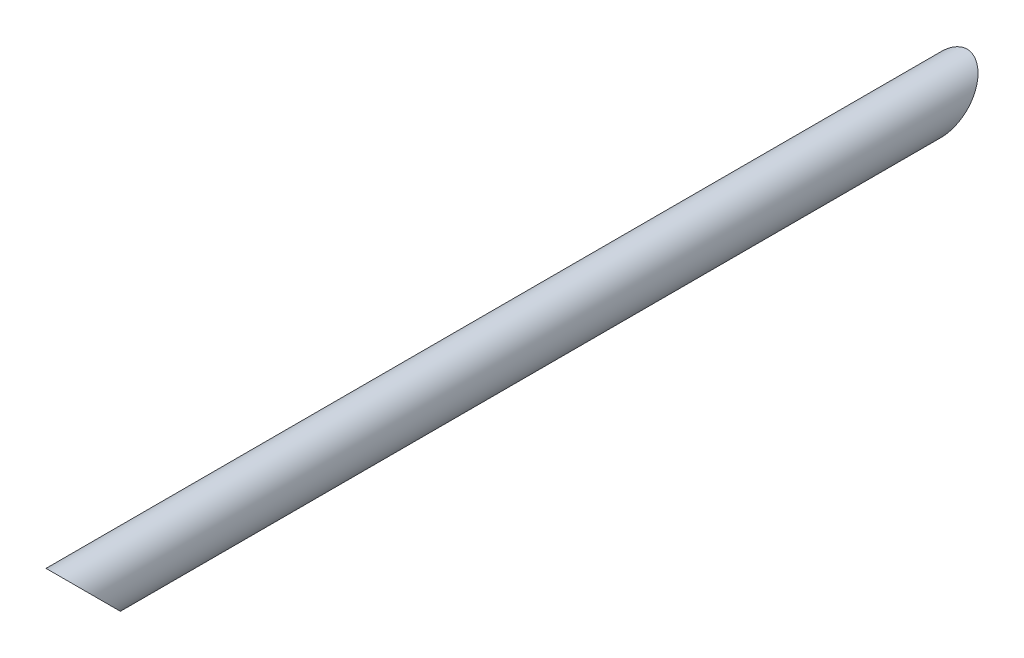
from build123d import *

# Parameters (mm, degrees)
SKETCH1_R               = 26.9875
BOSS_EXTRUDE1_DEPTH     = 933.45
CUT_EXTRUDE2_DEPTH      = 935.229925025
CUT_EXTRUDE2_DEPTH_BACK = 935.229925025


with BuildPart() as part:
    # Sketch1 → Boss-Extrude1 (new body)
    with BuildSketch(Plane.XY):
        Circle(SKETCH1_R)
    extrude(amount=BOSS_EXTRUDE1_DEPTH)

    # Sketch2 → Cut-Extrude2 (cut, two sides: drawn at the far end of the back side and taken through both)
    with BuildSketch(Plane(origin=(0, 0, 0), x_dir=(0, 0, -1), z_dir=(1, 0, 0)).offset(-CUT_EXTRUDE2_DEPTH_BACK)):
        Polygon((-933.45, 26.9875), (-879.475, -26.9875), (-933.45, -26.9875), align=None)
        Polygon((0, 26.9875), (-53.975, -26.9875), (0, -26.9875), align=None)
    extrude(amount=CUT_EXTRUDE2_DEPTH + CUT_EXTRUDE2_DEPTH_BACK, mode=Mode.SUBTRACT)


solid = part.part
